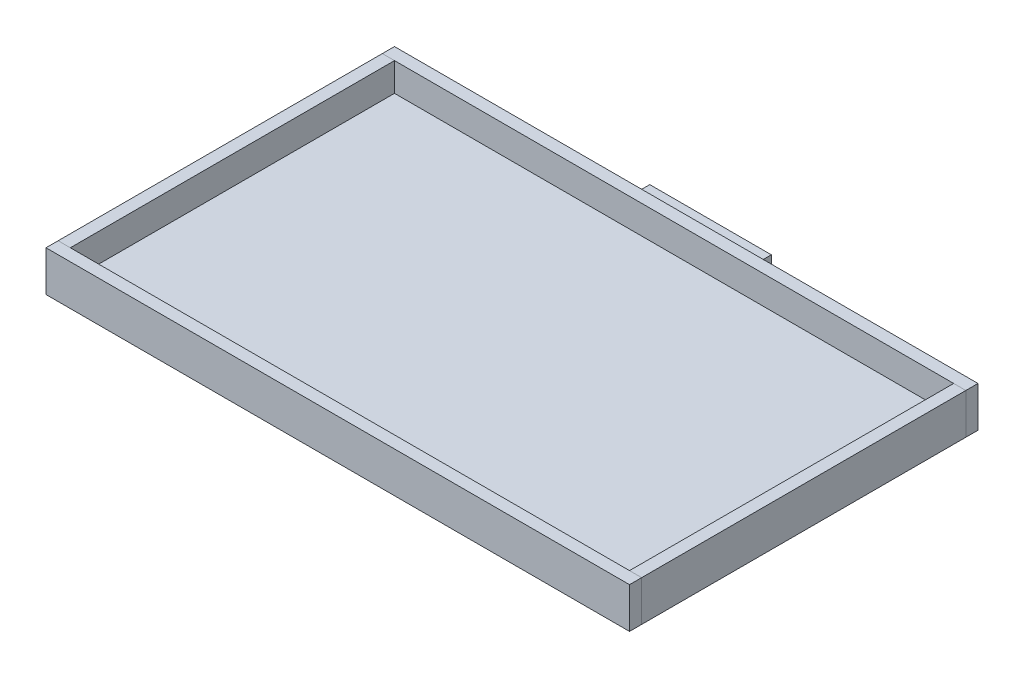
from build123d import *

# Parameters (mm, degrees)
SKETCH1_W           = 876.3
SKETCH1_H           = 508
BOSS_EXTRUDE1_DEPTH = 19.05
SKETCH2_W           = 914.4
SKETCH2_H           = 63.5
BOSS_EXTRUDE2_DEPTH = 19.05
SKETCH4_W           = 914.4
SKETCH4_H           = 63.5
BOSS_EXTRUDE3_DEPTH = 19.05
SKETCH5_W           = 508
SKETCH5_H           = 63.5
BOSS_EXTRUDE4_DEPTH = 19.05
SKETCH6_W           = 508
SKETCH6_H           = 63.5
BOSS_EXTRUDE5_DEPTH = 19.05
SKETCH7_W           = 190.5
SKETCH7_H           = 12.7
BOSS_EXTRUDE6_DEPTH = 38.1


with BuildPart() as part:
    # Sketch1 → Boss-Extrude1 (new body)
    with BuildSketch(Plane(origin=(0, 0, 0), x_dir=(1, 0, 0), z_dir=(0, 1, 0))):
        with Locations((438.15, 254)):
            Rectangle(SKETCH1_W, SKETCH1_H)
    extrude(amount=BOSS_EXTRUDE1_DEPTH)


with BuildPart() as body_2:
    # Sketch2 → Boss-Extrude2 (new body)
    with BuildSketch(Plane.XY):
        with Locations((438.15, 31.75)):
            Rectangle(SKETCH2_W, SKETCH2_H)
    extrude(amount=BOSS_EXTRUDE2_DEPTH)


with BuildPart() as body_3:
    # Sketch4 → Boss-Extrude3 (new body)
    with BuildSketch(Plane(origin=(0, 0, -508), x_dir=(-1, 0, 0), z_dir=(0, 0, -1))):
        with Locations((-438.15, 31.75)):
            Rectangle(SKETCH4_W, SKETCH4_H)
    extrude(amount=BOSS_EXTRUDE3_DEPTH)

    # Sketch7 → Boss-Extrude6 (add)
    with BuildSketch(Plane(origin=(0, 0, -527.05), x_dir=(-1, 0, 0), z_dir=(0, 0, -1))):
        with Locations((-438.15, 31.75)):
            Rectangle(SKETCH7_W, SKETCH7_H)
    extrude(amount=BOSS_EXTRUDE6_DEPTH)


with BuildPart() as body_4:
    # Sketch5 → Boss-Extrude4 (new body)
    with BuildSketch(Plane(origin=(0, 0, 0), x_dir=(0, 0, -1), z_dir=(1, 0, 0))):
        with Locations((254, 31.75)):
            Rectangle(SKETCH5_W, SKETCH5_H)
    extrude(amount=-BOSS_EXTRUDE4_DEPTH)


with BuildPart() as body_5:
    # Sketch6 → Boss-Extrude5 (new body)
    with BuildSketch(Plane(origin=(876.3, 0, 0), x_dir=(0, 0, -1), z_dir=(1, 0, 0))):
        with Locations((254, 31.75)):
            Rectangle(SKETCH6_W, SKETCH6_H)
    extrude(amount=BOSS_EXTRUDE5_DEPTH)


solid = Compound([part.part, body_2.part, body_3.part, body_4.part, body_5.part])
